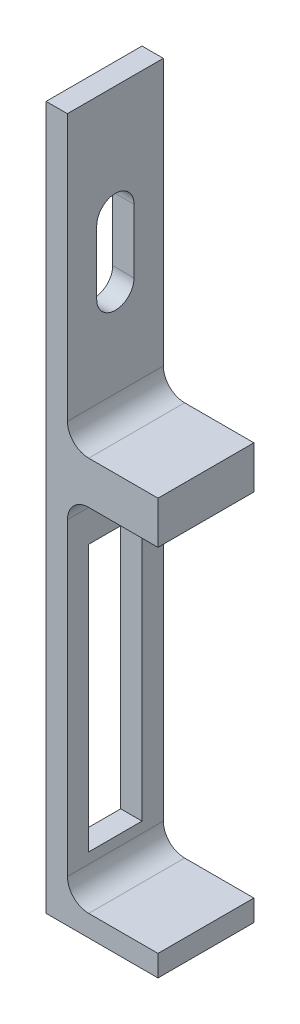
from build123d import *

# Parameters (mm, degrees)
EXTRUDE_1_DEPTH     = 9
CUT_EXTRUDE_2_DEPTH = 68.433300379
SKETCH_6_W          = 5
SKETCH_6_H          = 25
CUT_EXTRUDE_3_DEPTH = 68.15094936
FILLET_1_R          = 2
SKETCH_7_W          = 8.5
SKETCH_7_H          = 4
EXTRUDE_2_DEPTH     = 9
FILLET_2_R          = 2


with BuildPart() as part:
    # Эскиз1 → Бобышка-Вытянуть1 (new body)
    with BuildSketch(Plane.XY):
        Polygon((0, 0), (10.5, 0), (10.5, 2), (2, 2), (2, 66), (0, 66), align=None)
    extrude(amount=EXTRUDE_1_DEPTH)

    # Эскиз4 → Вырез-Вытянуть2 (cut, through all)
    with BuildSketch(Plane.ZY):
        with BuildLine():
            Line((6.25, 55.52), (6.25, 49.52))
            ThreePointArc((6.25, 49.52), (4.5, 47.77), (2.75, 49.52))
            Line((2.75, 49.52), (2.75, 55.52))
            ThreePointArc((2.75, 55.52), (4.5, 57.27), (6.25, 55.52))
        make_face()
    extrude(amount=-CUT_EXTRUDE_2_DEPTH, mode=Mode.SUBTRACT)

    # Эскиз6 → Вырез-Вытянуть3 (cut, through all)
    with BuildSketch(Plane(origin=(2, 0, 0), x_dir=(0, 0, -1), z_dir=(1, 0, 0))):
        with Locations((-4.5, 17.5)):
            Rectangle(SKETCH_6_W, SKETCH_6_H)
    extrude(amount=-CUT_EXTRUDE_3_DEPTH, mode=Mode.SUBTRACT)

    # Скругление1
    fillet_1_edges = [part.edges().sort_by_distance(p)[0] for p in [
        (2, 2, 4.5),
    ]]
    fillet(fillet_1_edges, radius=FILLET_1_R)

    # Эскиз7 → Бобышка-Вытянуть2 (add)
    with BuildSketch(Plane.XY.offset(9)):
        with Locations((6.25, 37)):
            Rectangle(SKETCH_7_W, SKETCH_7_H)
    extrude(amount=-EXTRUDE_2_DEPTH)

    # Скругление2
    fillet_2_edges = [part.edges().sort_by_distance(p)[0] for p in [
        (2, 39, 4.5),
        (2, 35, 4.5),
    ]]
    fillet(fillet_2_edges, radius=FILLET_2_R)


solid = part.part
